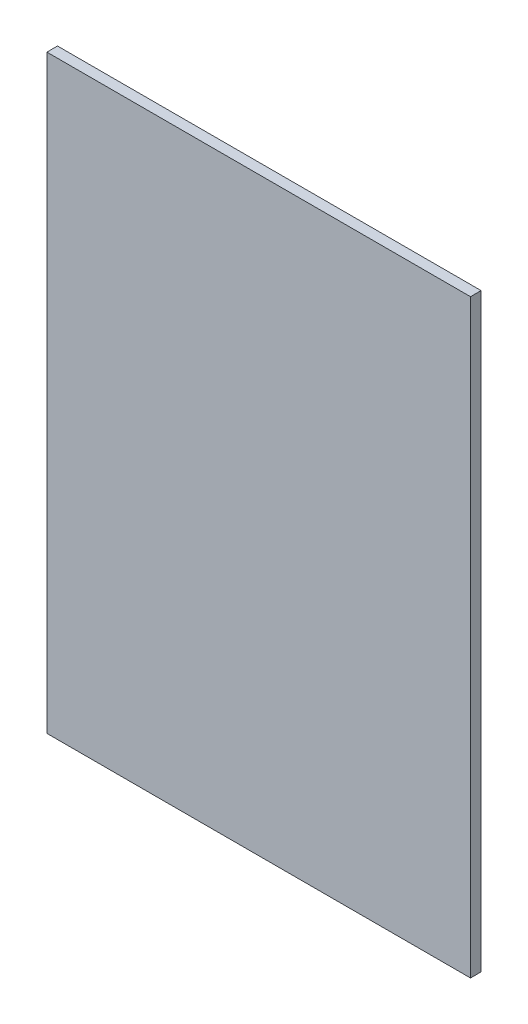
from build123d import *

# Parameters (mm, degrees)
SKETCH_1_W      = 200
SKETCH_1_H      = 278.570832902
EXTRUDE_1_DEPTH = 5


with BuildPart() as part:
    # 스케치1 → 보스-돌출1 (new body)
    with BuildSketch(Plane.XY):
        with Locations((-2393.613927197, -139.285416451)):
            Rectangle(SKETCH_1_W, SKETCH_1_H)
    extrude(amount=EXTRUDE_1_DEPTH)


solid = part.part
